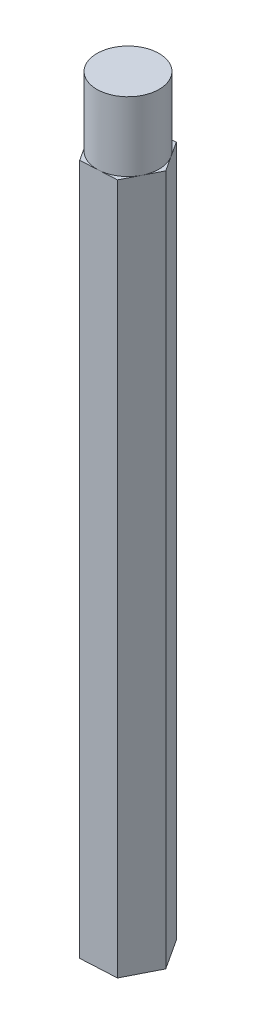
from build123d import *

# Parameters (mm, degrees)
BOSS_EXTRUDE1_DEPTH = 50.8
SKETCH1_3_R         = 2.286
BOSS_EXTRUDE2_DEPTH = 55.88


with BuildPart() as part:
    # Sketch1 → Boss-Extrude1 (new body)
    with BuildSketch(Plane(origin=(0, 0, 0), x_dir=(1, 0, 0), z_dir=(0, 1, 0))):
        Polygon((1.43881726, -2.213037029), (2.635954917, 0.139533783), (1.197137657, 2.352570813), (-1.43881726, 2.213037029), (-2.635954917, -0.139533783), (-1.197137657, -2.352570813), align=None)
    extrude(amount=BOSS_EXTRUDE1_DEPTH)

    # Sketch1<3> → Boss-Extrude2 (add)
    with BuildSketch(Plane(origin=(0, 0, 0), x_dir=(1, 0, 0), z_dir=(0, 1, 0))):
        Circle(SKETCH1_3_R)
    extrude(amount=BOSS_EXTRUDE2_DEPTH)


solid = part.part
